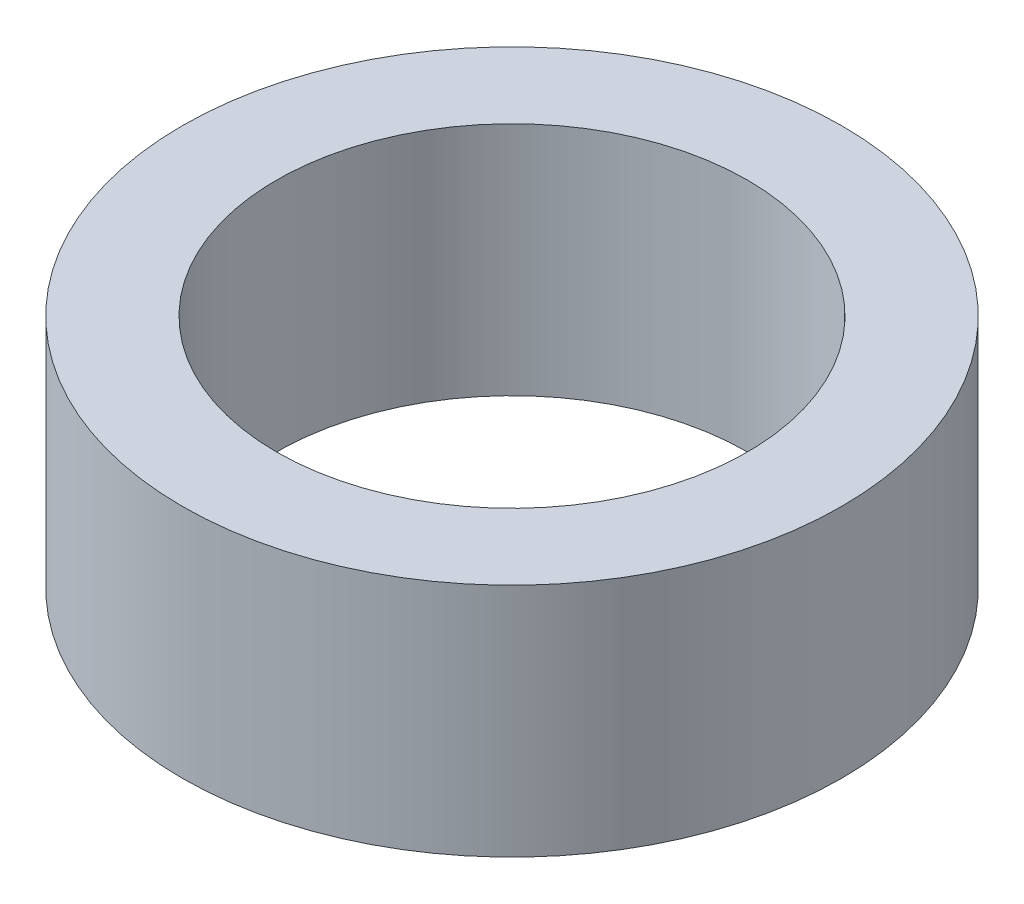
from build123d import *

# Parameters (mm, degrees)
SKETCH1_R           = 7
SKETCH1_R_2         = 5
BOSS_EXTRUDE1_DEPTH = 5


with BuildPart() as part:
    # Sketch1 → Boss-Extrude1 (new body)
    with BuildSketch(Plane(origin=(0, 0, 0), x_dir=(1, 0, 0), z_dir=(0, 1, 0))):
        with Locations(Location((0, 0, 0), (0, 0, 270))):
            Circle(SKETCH1_R)
        with Locations(Location((0, 0, 0), (0, 0, 270))):
            Circle(SKETCH1_R_2, mode=Mode.SUBTRACT)
    extrude(amount=BOSS_EXTRUDE1_DEPTH)


solid = part.part
